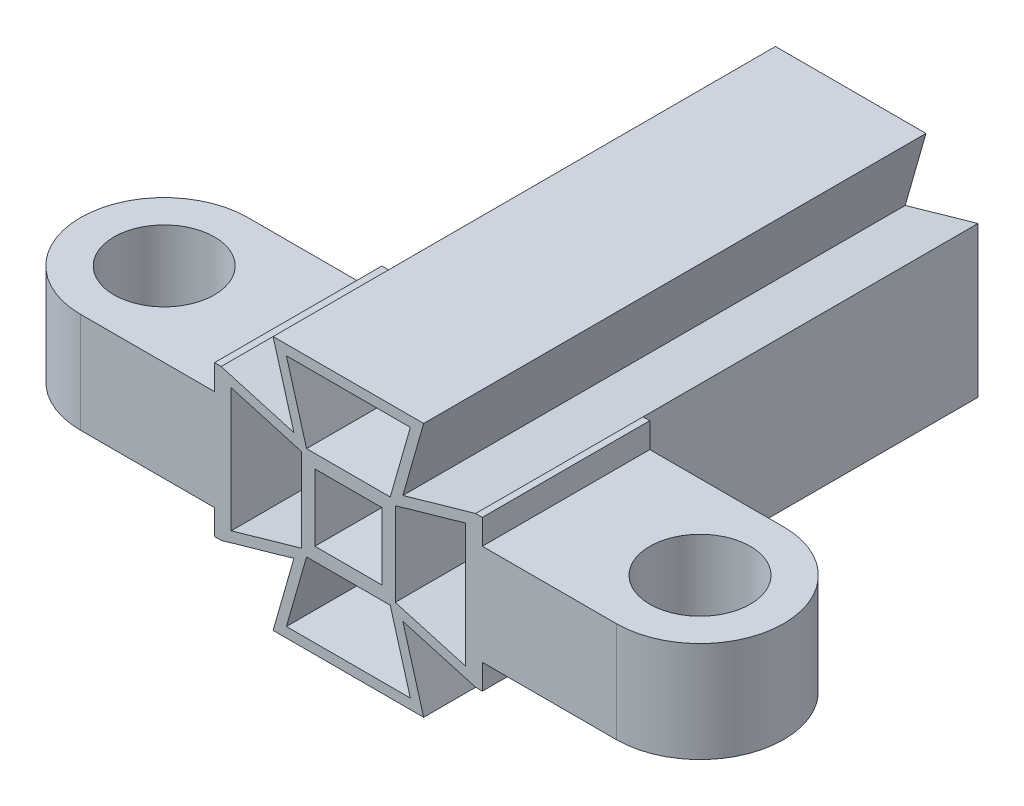
from build123d import *

# Parameters (mm, degrees)
SKETCH1_W           = 20
SKETCH1_H           = 20
BOSS_EXTRUDE1_DEPTH = 150
SKETCH2_W           = 7
SKETCH2_H           = 21
SKETCH2_W_2         = 21
SKETCH2_H_2         = 7
BOSS_EXTRUDE2_DEPTH = 2
BOSS_EXTRUDE3_DEPTH = 50
SKETCH4_R           = 15
CUT_EXTRUDE1_DEPTH  = 50


with BuildPart() as part:
    # Sketch1 → Boss-Extrude1 (new body)
    with BuildSketch(Plane.XY):
        Polygon((22.477189953, 38), (-22.477189953, 38), (-16.268065934, 16.268065934), (-38, 22.477189953), (-38, -22.477189953), (-16.268065934, -16.268065934), (-22.477189953, -38), (22.477189953, -38), (16.268065934, -16.268065934), (38, -22.477189953), (38, 22.477189953), (16.268065934, 16.268065934), align=None)
        Polygon((12.5, 14), (-12.5, 14), (-18.5, 35), (18.5, 35), align=None, mode=Mode.SUBTRACT)
        Rectangle(SKETCH1_W, SKETCH1_H, mode=Mode.SUBTRACT)
        Polygon((14, -12.5), (14, 12.5), (35, 18.5), (35, -18.5), align=None, mode=Mode.SUBTRACT)
        Polygon((-12.5, -14), (12.5, -14), (18.5, -35), (-18.5, -35), align=None, mode=Mode.SUBTRACT)
        Polygon((-14, 12.5), (-14, -12.5), (-35, -18.5), (-35, 18.5), align=None, mode=Mode.SUBTRACT)
    extrude(amount=BOSS_EXTRUDE1_DEPTH)

    # Sketch2 → Boss-Extrude2 (add)
    with BuildSketch(Plane.XY):
        with Locations((0, 24.5)):
            Rectangle(SKETCH2_W, SKETCH2_H)
        with Locations((24.5, 0)):
            Rectangle(SKETCH2_W_2, SKETCH2_H_2)
        with Locations((0, -24.5)):
            Rectangle(SKETCH2_W, SKETCH2_H)
        with Locations((-24.5, 0)):
            Rectangle(SKETCH2_W_2, SKETCH2_H_2)
    extrude(amount=BOSS_EXTRUDE2_DEPTH)

    # Sketch3 → Boss-Extrude3 (add)
    with BuildSketch(Plane.XY.offset(150)):
        Polygon((40, -22.477189953), (40, -15), (105, -15), (105, 15), (40, 15), (40, 22.477189953), (38, 22.477189953), (38, -22.477189953), align=None)
        Polygon((-38, 22.477189953), (-40, 22.477189953), (-40, 15), (-105, 15), (-105, -15), (-40, -15), (-40, -22.477189953), (-38, -22.477189953), align=None)
    extrude(amount=-BOSS_EXTRUDE3_DEPTH)

    # Sketch4 → Cut-Extrude1 (cut)
    with BuildSketch(Plane(origin=(0, 15, 0), x_dir=(1, 0, 0), z_dir=(0, 1, 0))):
        with Locations(Location((80, -125, 0), (0, 0, 270))):
            Circle(SKETCH4_R)
        with Locations(Location((-80, -125, 0), (0, 0, 270))):
            Circle(SKETCH4_R)
        with BuildLine():
            Line((80, -100), (80, -91.906284046))
            Line((80, -91.906284046), (116.237187359, -91.906284046))
            Line((116.237187359, -91.906284046), (116.237187359, -153.794533515))
            Line((116.237187359, -153.794533515), (80, -153.794533515))
            Line((80, -153.794533515), (80, -150))
            ThreePointArc((80, -150), (105, -125), (80, -100))
        make_face()
        with BuildLine():
            Line((-80, -153.794533515), (-80, -150))
            ThreePointArc((-80, -150), (-105, -125), (-80, -100))
            Line((-80, -100), (-80, -91.906284046))
            Line((-80, -91.906284046), (-116.237187359, -91.906284046))
            Line((-116.237187359, -91.906284046), (-116.237187359, -153.794533515))
            Line((-116.237187359, -153.794533515), (-80, -153.794533515))
        make_face()
    extrude(amount=-CUT_EXTRUDE1_DEPTH, mode=Mode.SUBTRACT)


solid = part.part
